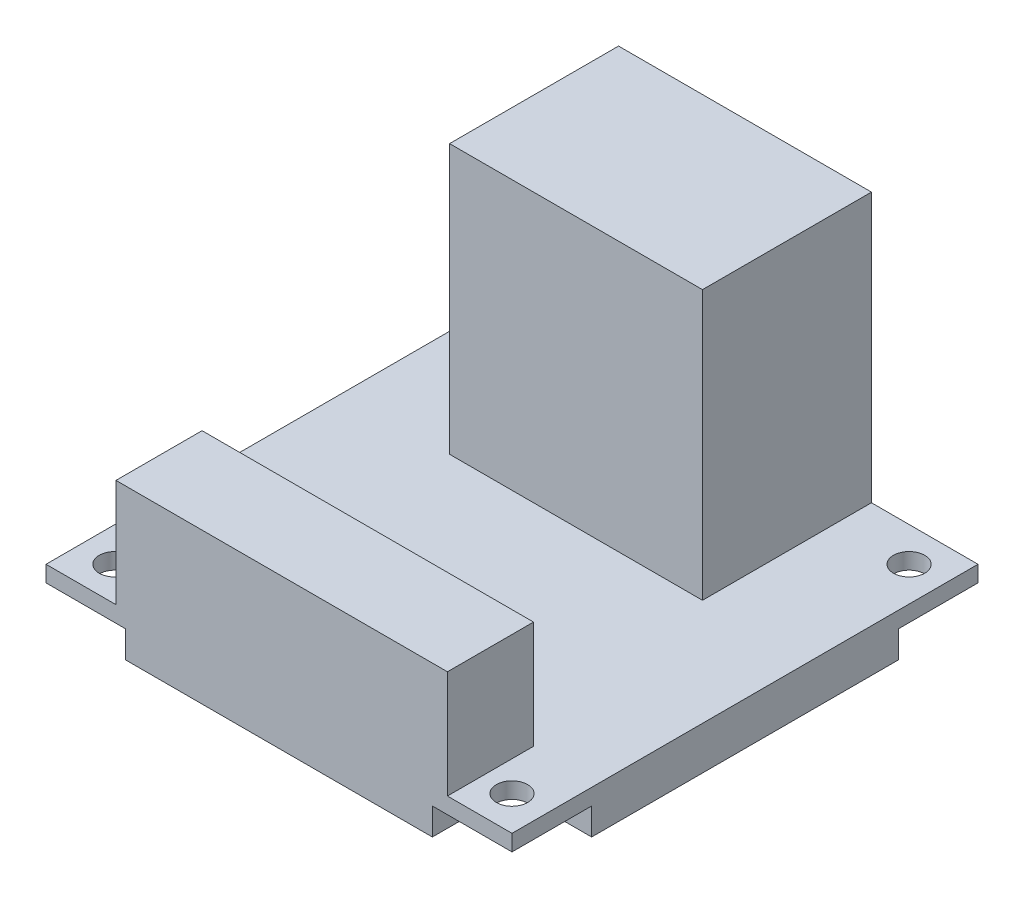
from build123d import *

# Parameters (mm, degrees)
SKETCH1_W           = 43.3
SKETCH1_H           = 43.3
SKETCH1_R           = 1.45
BOSS_EXTRUDE1_DEPTH = 1.5
BOSS_EXTRUDE2_DEPTH = 2.5
SKETCH3_W           = 30.8
SKETCH3_H           = 8
BOSS_EXTRUDE3_DEPTH = 10
SKETCH4_W           = 23.5
SKETCH4_H           = 15.7
BOSS_EXTRUDE4_DEPTH = 25


with BuildPart() as part:
    # Sketch1 → Boss-Extrude1 (new body)
    with BuildSketch(Plane(origin=(0, 0, 0), x_dir=(1, 0, 0), z_dir=(0, 1, 0))):
        with Locations((21.65, 21.65)):
            Rectangle(SKETCH1_W, SKETCH1_H)
        with Locations(Location((3.2, 3.2, 0), (0, 0, 270))):
            Circle(SKETCH1_R, mode=Mode.SUBTRACT)
        with Locations(Location((3.2, 40.1, 0), (0, 0, 270))):
            Circle(SKETCH1_R, mode=Mode.SUBTRACT)
        with Locations(Location((40.1, 40.1, 0), (0, 0, 270))):
            Circle(SKETCH1_R, mode=Mode.SUBTRACT)
        with Locations(Location((40.1, 3.2, 0), (0, 0, 270))):
            Circle(SKETCH1_R, mode=Mode.SUBTRACT)
    extrude(amount=BOSS_EXTRUDE1_DEPTH)

    # Sketch2 → Boss-Extrude2 (add)
    with BuildSketch(Plane.XZ):
        Polygon((0, -35.9), (0, -7.4), (7.4, -7.4), (7.4, 0), (35.9, 0), (35.9, -7.4), (43.3, -7.4), (43.3, -35.9), (35.9, -35.9), (35.9, -43.3), (7.4, -43.3), (7.4, -35.9), align=None)
    extrude(amount=BOSS_EXTRUDE2_DEPTH)

    # Sketch3 → Boss-Extrude3 (add)
    with BuildSketch(Plane(origin=(0, 1.5, 0), x_dir=(1, 0, 0), z_dir=(0, 1, 0))):
        with Locations((21.9, 4)):
            Rectangle(SKETCH3_W, SKETCH3_H)
    extrude(amount=BOSS_EXTRUDE3_DEPTH)

    # Sketch4 → Boss-Extrude4 (add)
    with BuildSketch(Plane(origin=(0, 1.5, 0), x_dir=(1, 0, 0), z_dir=(0, 1, 0))):
        with Locations((21.65, 35.45)):
            Rectangle(SKETCH4_W, SKETCH4_H)
    extrude(amount=BOSS_EXTRUDE4_DEPTH)


solid = part.part
